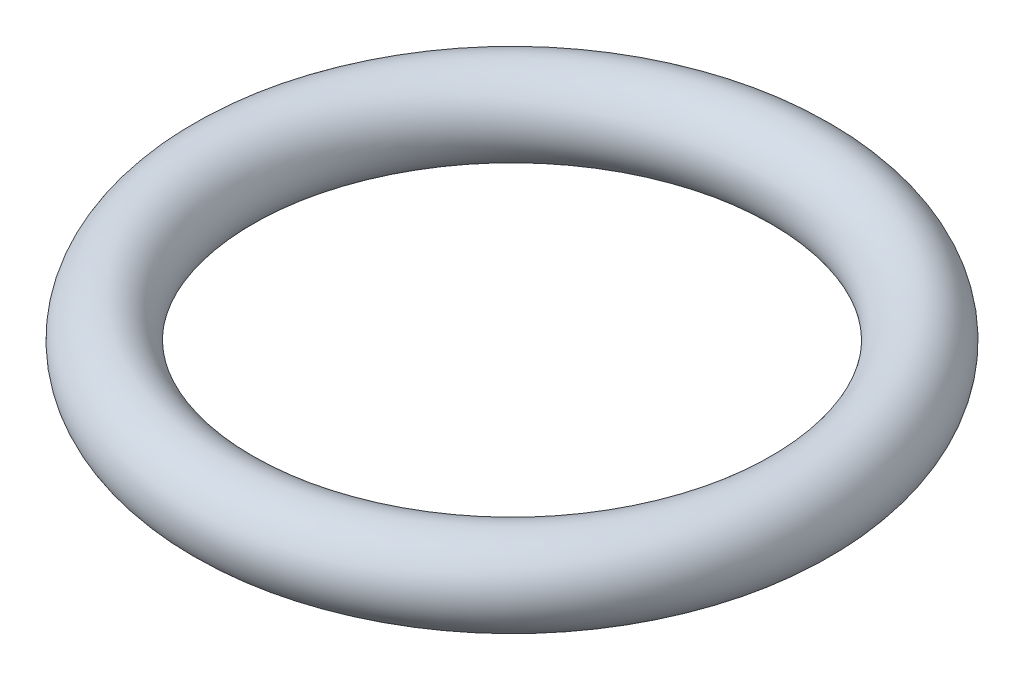
from build123d import *

# Parameters (mm, degrees)
SKETCH2_R = 0.75


with BuildPart() as part:
    # Sketch2 → Revolve1 (revolve)
    with BuildSketch(Plane.XY, mode=Mode.PRIVATE) as revolve1_sk:
        with Locations((5.25, 0)):
            Circle(SKETCH2_R)
    revolve(revolve1_sk.sketch.rotate(Axis((0, 0, 0), (0, 1, 0)), 90), axis=Axis((0, 0, 0), (0, 1, 0)))


solid = part.part
